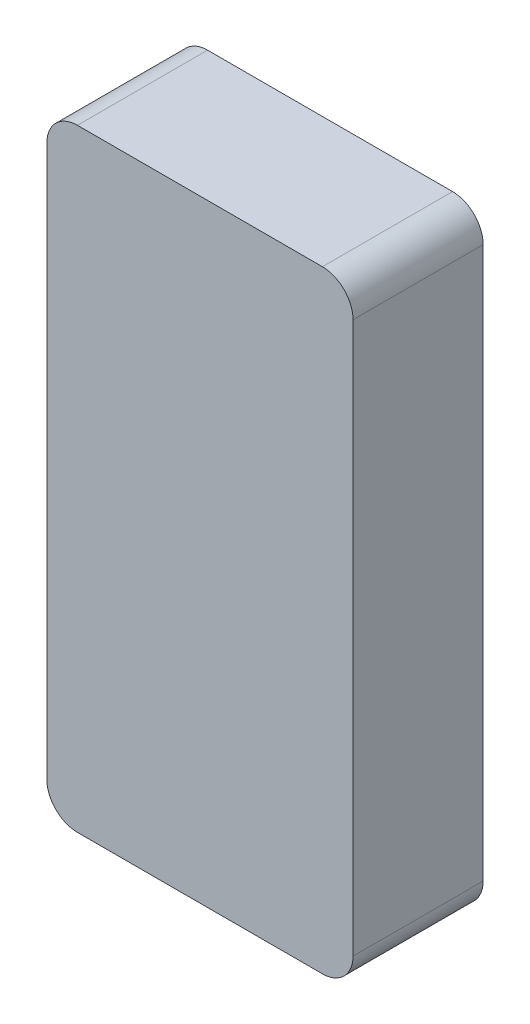
from build123d import *

# Parameters (mm, degrees)
SKETCH1_W           = 20
SKETCH1_H           = 40
BOSS_EXTRUDE1_DEPTH = 8.5
FILLET1_R           = 2


with BuildPart() as part:
    # Sketch1 → Boss-Extrude1 (new body)
    with BuildSketch(Plane.XY):
        Rectangle(SKETCH1_W, SKETCH1_H)
    extrude(amount=BOSS_EXTRUDE1_DEPTH)

    # Fillet1
    fillet1_edges = [part.edges().sort_by_distance(p)[0] for p in [
        (-10, 20, 4.25),
        (10, 20, 4.25),
        (10, -20, 4.25),
        (-10, -20, 4.25),
    ]]
    fillet(fillet1_edges, radius=FILLET1_R)


solid = part.part
